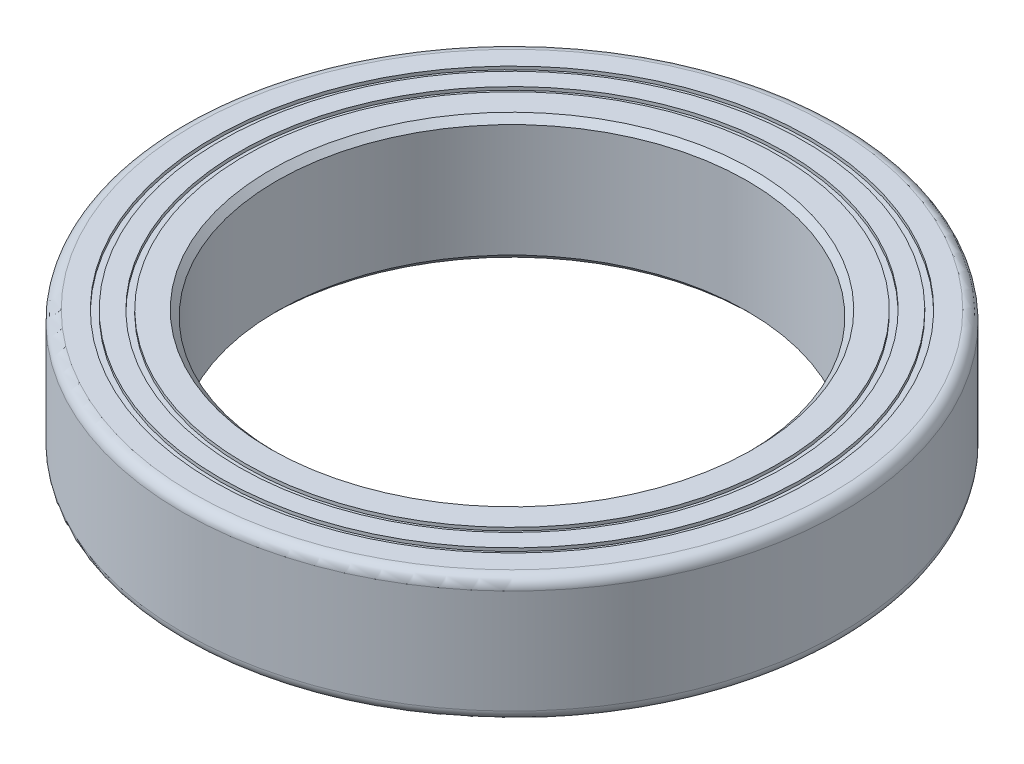
from build123d import *

# Parameters (mm, degrees)
FILLET2_R     = 0.344
CHAMFER2_SIZE = 0.2


with BuildPart() as part:
    # Sketch1 → Revolve1 (revolve)
    with BuildSketch(Plane.XY, mode=Mode.PRIVATE) as revolve1_sk:
        Polygon((10.5, 0), (10.5, 4), (9.5, 4), (9.5, 3.9), (9.3, 3.9), (9.3, 4), (8.7, 4), (8.7, 3.9), (8.5, 3.9), (8.5, 4), (7.5, 4), (7.5, 0), (8.5, 0), (8.5, 0.1), (8.7, 0.1), (8.7, 0), (9.3, 0), (9.3, 0.1), (9.5, 0.1), (9.5, 0), align=None)
    revolve(revolve1_sk.sketch.rotate(Axis((0, 2, 0), (0, -1, 0)), 90), axis=Axis((0, 2, 0), (0, -1, 0)))

    # Fillet2
    fillet2_edges = [part.edges().sort_by_distance(p)[0] for p in [
        (0, 0, -10.5),
        (0, 4, -10.5),
    ]]
    fillet(fillet2_edges, radius=FILLET2_R)

    # Chamfer2
    chamfer2_edges = [part.edges().sort_by_distance(p)[0] for p in [
        (0, 4, -7.5),
        (0, 0, -7.5),
    ]]
    chamfer(chamfer2_edges, length=CHAMFER2_SIZE)


solid = part.part
